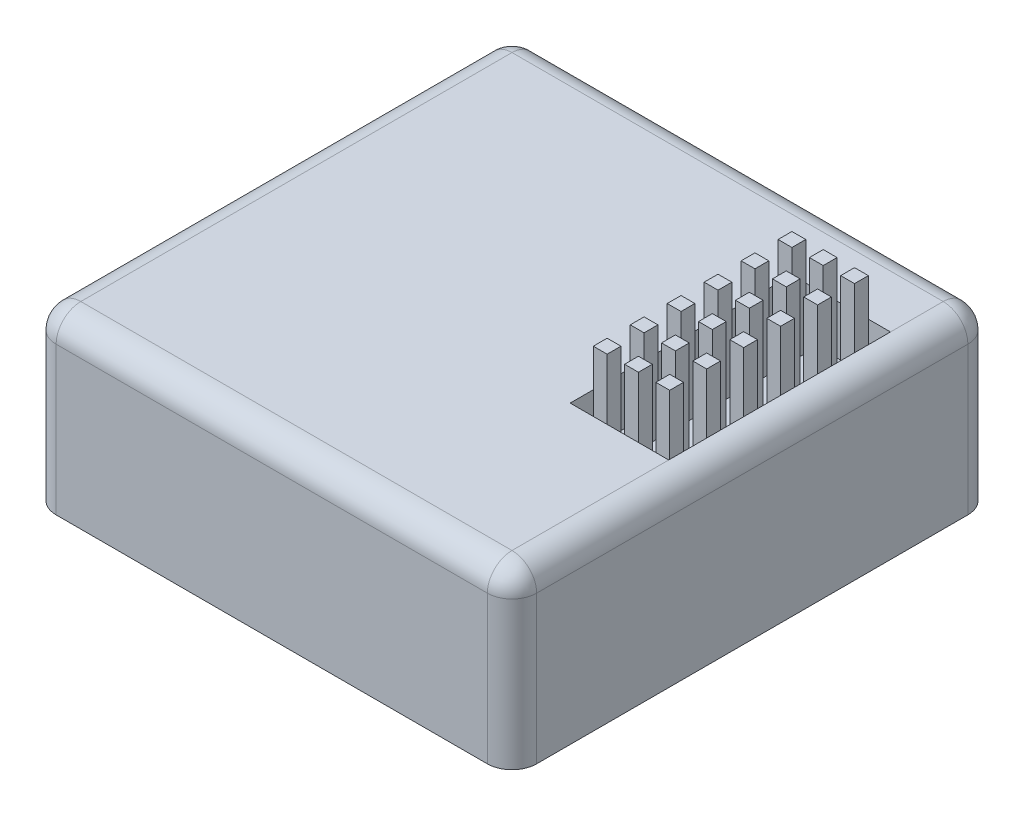
from build123d import *

# Parameters (mm, degrees)
SKETCH1_W           = 39
SKETCH1_H           = 39
BOSS_EXTRUDE1_DEPTH = 14
FILLET1_R           = 2
FILLET2_R           = 2
SKETCH2_W           = 8
SKETCH2_H           = 18
SKETCH2_W_2         = 1.12294134
SKETCH2_H_2         = 1.122941341
CUT_EXTRUDE1_DEPTH  = 4
SKETCH2_2_W         = 1.12294134
SKETCH2_2_H         = 1.122941341
BOSS_EXTRUDE3_DEPTH = 4
SKETCH3_W           = 7
SKETCH3_H           = 3
CUT_EXTRUDE2_DEPTH  = 2


with BuildPart() as part:
    # Sketch1 → Boss-Extrude1 (new body)
    with BuildSketch(Plane(origin=(0, 0, 0), x_dir=(1, 0, 0), z_dir=(0, 1, 0))):
        Rectangle(SKETCH1_W, SKETCH1_H)
    extrude(amount=BOSS_EXTRUDE1_DEPTH)

    # Fillet1
    fillet1_edges = [part.edges().sort_by_distance(p)[0] for p in [
        (-19.5, 7, 19.5),
        (-19.5, 7, -19.5),
        (19.5, 7, -19.5),
        (19.5, 7, 19.5),
    ]]
    fillet(fillet1_edges, radius=FILLET1_R)

    # Fillet2
    fillet2_edges = [part.edges().sort_by_distance(p)[0] for p in [
        (-18.914213562, 14, -18.914213562),
        (0, 14, -19.5),
        (18.914213562, 14, -18.914213562),
        (19.5, 14, 0),
        (18.914213562, 14, 18.914213562),
        (0, 14, 19.5),
        (-18.914213562, 14, 18.914213562),
        (-19.5, 14, 0),
    ]]
    fillet(fillet2_edges, radius=FILLET2_R)

    # Sketch2 → Cut-Extrude1 (cut)
    with BuildSketch(Plane(origin=(0, 14, 0), x_dir=(1, 0, 0), z_dir=(0, 1, 0))):
        with Locations((13.5, 4.220700243)):
            Rectangle(SKETCH2_W, SKETCH2_H)
        with Locations((13.54, 11.720700244)):
            Rectangle(SKETCH2_W_2, SKETCH2_H_2, mode=Mode.SUBTRACT)
        with Locations((11, 11.720700244)):
            Rectangle(SKETCH2_W_2, SKETCH2_H_2, mode=Mode.SUBTRACT)
        with Locations((16.08, 11.720700244)):
            Rectangle(SKETCH2_W_2, SKETCH2_H_2, mode=Mode.SUBTRACT)
        with Locations((11, 8.720700244)):
            Rectangle(SKETCH2_W_2, SKETCH2_H_2, mode=Mode.SUBTRACT)
        with Locations((13.54, 8.720700244)):
            Rectangle(SKETCH2_W_2, SKETCH2_H_2, mode=Mode.SUBTRACT)
        with Locations((16.08, 8.720700244)):
            Rectangle(SKETCH2_W_2, SKETCH2_H_2, mode=Mode.SUBTRACT)
        with Locations((11, 5.720700244)):
            Rectangle(SKETCH2_W_2, SKETCH2_H_2, mode=Mode.SUBTRACT)
        with Locations((13.54, 5.720700244)):
            Rectangle(SKETCH2_W_2, SKETCH2_H_2, mode=Mode.SUBTRACT)
        with Locations((16.08, 5.720700244)):
            Rectangle(SKETCH2_W_2, SKETCH2_H_2, mode=Mode.SUBTRACT)
        with Locations((11, 2.720700244)):
            Rectangle(SKETCH2_W_2, SKETCH2_H_2, mode=Mode.SUBTRACT)
        with Locations((13.54, 2.720700244)):
            Rectangle(SKETCH2_W_2, SKETCH2_H_2, mode=Mode.SUBTRACT)
        with Locations((16.08, 2.720700244)):
            Rectangle(SKETCH2_W_2, SKETCH2_H_2, mode=Mode.SUBTRACT)
        with Locations((11, -0.279299757)):
            Rectangle(SKETCH2_W_2, SKETCH2_H_2, mode=Mode.SUBTRACT)
        with Locations((13.54, -0.279299757)):
            Rectangle(SKETCH2_W_2, SKETCH2_H_2, mode=Mode.SUBTRACT)
        with Locations((16.08, -0.279299757)):
            Rectangle(SKETCH2_W_2, SKETCH2_H_2, mode=Mode.SUBTRACT)
        with Locations((11, -3.279299757)):
            Rectangle(SKETCH2_W_2, SKETCH2_H_2, mode=Mode.SUBTRACT)
        with Locations((13.54, -3.279299757)):
            Rectangle(SKETCH2_W_2, SKETCH2_H_2, mode=Mode.SUBTRACT)
        with Locations((16.08, -3.279299757)):
            Rectangle(SKETCH2_W_2, SKETCH2_H_2, mode=Mode.SUBTRACT)
    extrude(amount=-CUT_EXTRUDE1_DEPTH, mode=Mode.SUBTRACT)

    # Sketch2<2> → Boss-Extrude3 (add)
    with BuildSketch(Plane(origin=(0, 14, 0), x_dir=(1, 0, 0), z_dir=(0, 1, 0))):
        with Locations((13.54, 11.720700244)):
            Rectangle(SKETCH2_2_W, SKETCH2_2_H)
        with Locations((11, 11.720700244)):
            Rectangle(SKETCH2_2_W, SKETCH2_2_H)
        with Locations((16.08, 11.720700244)):
            Rectangle(SKETCH2_2_W, SKETCH2_2_H)
        with Locations((11, 8.720700244)):
            Rectangle(SKETCH2_2_W, SKETCH2_2_H)
        with Locations((13.54, 8.720700244)):
            Rectangle(SKETCH2_2_W, SKETCH2_2_H)
        with Locations((16.08, 8.720700244)):
            Rectangle(SKETCH2_2_W, SKETCH2_2_H)
        with Locations((11, 5.720700244)):
            Rectangle(SKETCH2_2_W, SKETCH2_2_H)
        with Locations((13.54, 5.720700244)):
            Rectangle(SKETCH2_2_W, SKETCH2_2_H)
        with Locations((16.08, 5.720700244)):
            Rectangle(SKETCH2_2_W, SKETCH2_2_H)
        with Locations((11, 2.720700244)):
            Rectangle(SKETCH2_2_W, SKETCH2_2_H)
        with Locations((13.54, 2.720700244)):
            Rectangle(SKETCH2_2_W, SKETCH2_2_H)
        with Locations((16.08, 2.720700244)):
            Rectangle(SKETCH2_2_W, SKETCH2_2_H)
        with Locations((11, -0.279299757)):
            Rectangle(SKETCH2_2_W, SKETCH2_2_H)
        with Locations((13.54, -0.279299757)):
            Rectangle(SKETCH2_2_W, SKETCH2_2_H)
        with Locations((16.08, -0.279299757)):
            Rectangle(SKETCH2_2_W, SKETCH2_2_H)
        with Locations((11, -3.279299757)):
            Rectangle(SKETCH2_2_W, SKETCH2_2_H)
        with Locations((13.54, -3.279299757)):
            Rectangle(SKETCH2_2_W, SKETCH2_2_H)
        with Locations((16.08, -3.279299757)):
            Rectangle(SKETCH2_2_W, SKETCH2_2_H)
    extrude(amount=BOSS_EXTRUDE3_DEPTH)

    # Sketch3 → Cut-Extrude2 (cut)
    with BuildSketch(Plane.ZY.offset(19.5)):
        with Locations((-0.380147746, 10.5)):
            Rectangle(SKETCH3_W, SKETCH3_H)
    extrude(amount=-CUT_EXTRUDE2_DEPTH, mode=Mode.SUBTRACT)


solid = part.part
